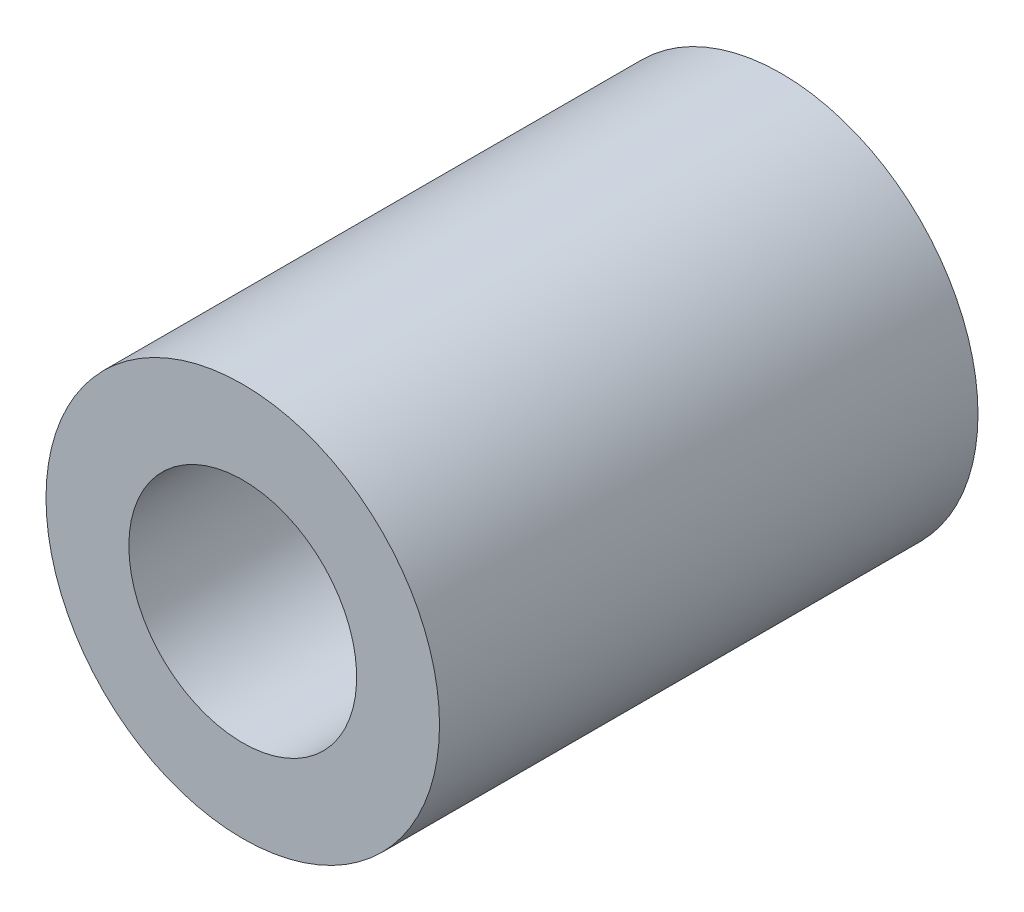
from build123d import *

# Parameters (mm, degrees)
CROQUIS1_R              = 4.75
CROQUIS1_R_2            = 2.75
SALIENTE_EXTRUIR1_DEPTH = 13


with BuildPart() as part:
    # Croquis1 → Saliente-Extruir1 (new body)
    with BuildSketch(Plane.XY):
        with Locations(Location((0, 0, 0), (0, 0, 180))):
            Circle(CROQUIS1_R)
        with Locations(Location((0, 0, 0), (0, 0, 180))):
            Circle(CROQUIS1_R_2, mode=Mode.SUBTRACT)
    extrude(amount=SALIENTE_EXTRUIR1_DEPTH)


solid = part.part
